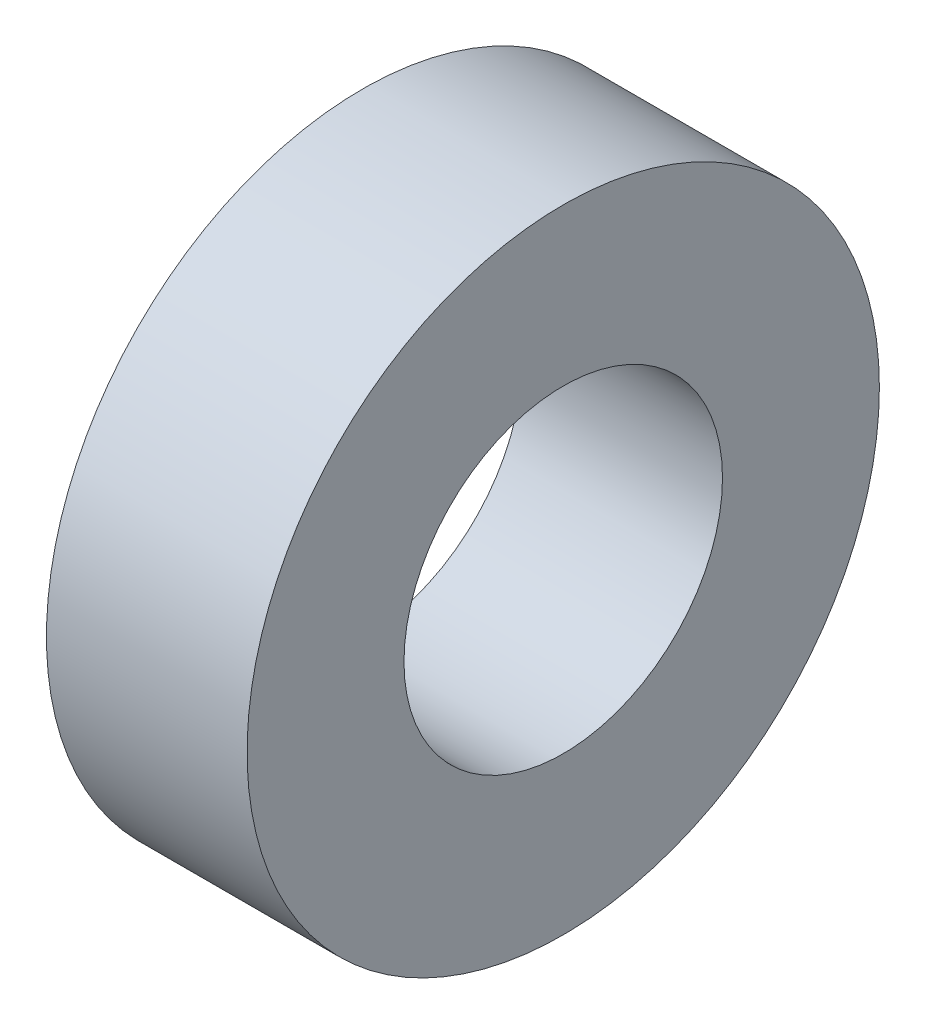
from build123d import *

# Parameters (mm, degrees)
SKETCH2_R           = 4.727157868
SKETCH2_R_2         = 2.38125
BOSS_EXTRUDE1_DEPTH = 1.5


with BuildPart() as part:
    # Sketch2 → Boss-Extrude1 (new, symmetric)
    with BuildSketch(Plane(origin=(0, 0, 0), x_dir=(0, 0, -1), z_dir=(1, 0, 0))):
        Circle(SKETCH2_R)
        Circle(SKETCH2_R_2, mode=Mode.SUBTRACT)
    extrude(amount=BOSS_EXTRUDE1_DEPTH, both=True)


solid = part.part
